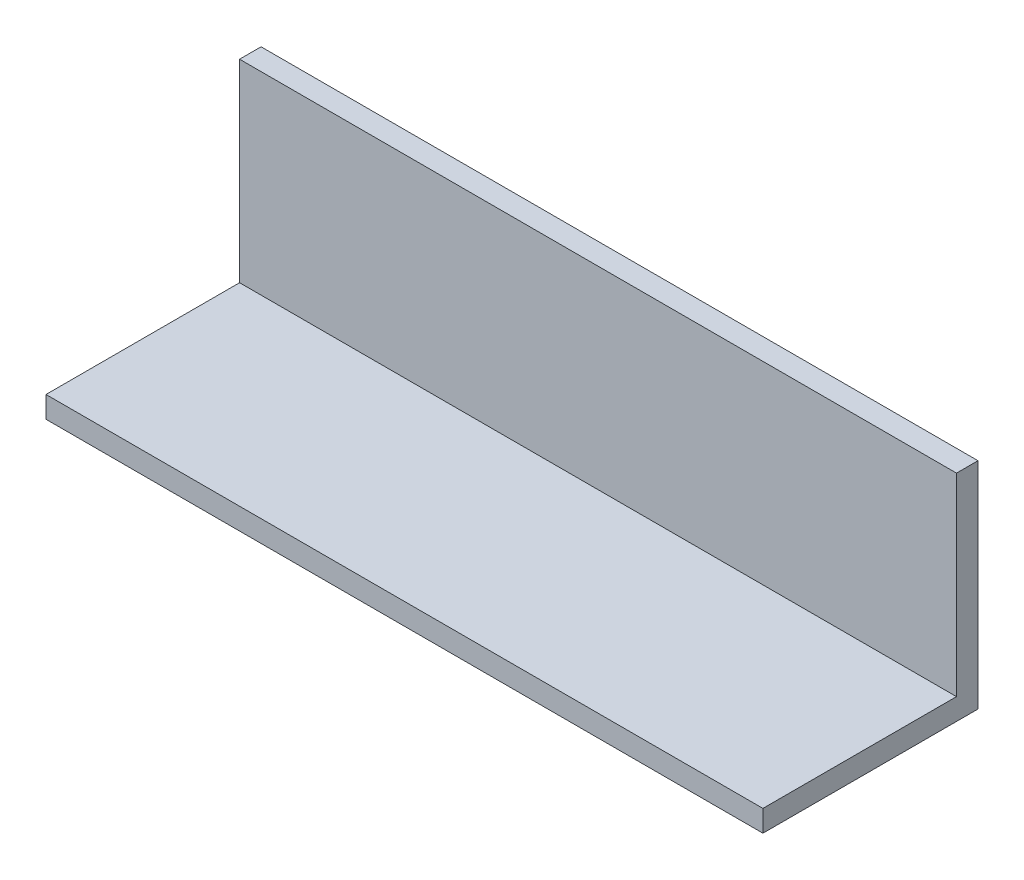
from build123d import *

# Parameters (mm, degrees)
SALIENTE_EXTRUIR1_DEPTH = 50


with BuildPart() as part:
    # Croquis1 → Saliente-Extruir1 (new body)
    with BuildSketch(Plane(origin=(0, 0, 0), x_dir=(0, 0, -1), z_dir=(1, 0, 0))):
        Polygon((0, 0), (-15, 0), (-15, 1.5), (-1.5, 1.5), (-1.5, 15), (0, 15), align=None)
    extrude(amount=SALIENTE_EXTRUIR1_DEPTH)


solid = part.part
